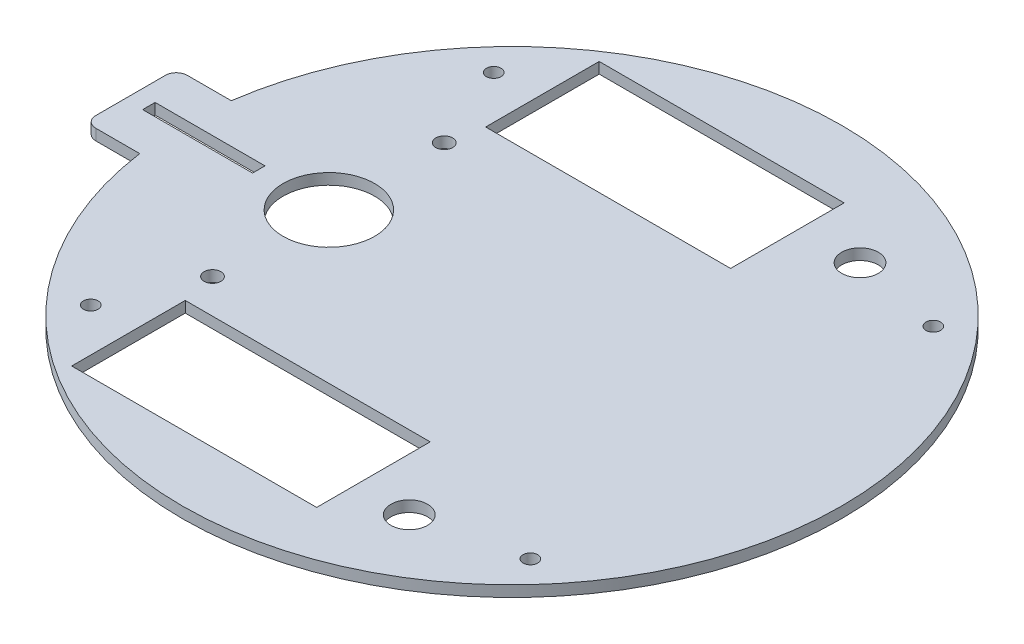
from build123d import *

# Parameters (mm, degrees)
SKETCH_2_R          = 90
EXTRUDE_1_DEPTH     = 3
SKETCH_3_W          = 66.868711174
SKETCH_3_H          = 31
CUT_EXTRUDE_1_DEPTH = 3
SKETCH_4_R          = 12.5
CUT_EXTRUDE_2_DEPTH = 3
SKETCH_5_R          = 2
CUT_EXTRUDE_3_DEPTH = 3
SKETCH_6_R          = 5
CUT_EXTRUDE_4_DEPTH = 10
SKETCH_7_R          = 2.3
CUT_EXTRUDE_5_DEPTH = 3
EXTRUDE_2_DEPTH     = 3
SKETCH_9_W          = 30
SKETCH_9_H          = 3.4
CUT_EXTRUDE_6_DEPTH = 3


with BuildPart() as part:
    # 草圖2 → 填料-伸長1 (new body)
    with BuildSketch(Plane(origin=(0, 0, 0), x_dir=(1, 0, 0), z_dir=(0, 1, 0))):
        with Locations(Location((0, 0, 0), (0, 0, 270))):
            Circle(SKETCH_2_R)
    extrude(amount=EXTRUDE_1_DEPTH)

    # 草圖3 → 除料-伸長1 (cut)
    with BuildSketch(Plane(origin=(0, 3, 0), x_dir=(1, 0, 0), z_dir=(0, 1, 0))):
        with Locations((-14.765632174, 56.5)):
            Rectangle(SKETCH_3_W, SKETCH_3_H)
        with Locations((-14.765632174, -56.5)):
            Rectangle(SKETCH_3_W, SKETCH_3_H)
    extrude(amount=-CUT_EXTRUDE_1_DEPTH, mode=Mode.SUBTRACT)

    # 草圖4 → 除料-伸長2 (cut)
    with BuildSketch(Plane(origin=(0, 3, 0), x_dir=(1, 0, 0), z_dir=(0, 1, 0))):
        with Locations(Location((-50, 0, 0), (0, 0, 270))):
            Circle(SKETCH_4_R)
    extrude(amount=-CUT_EXTRUDE_2_DEPTH, mode=Mode.SUBTRACT)

    # 草圖5 → 除料-伸長3 (cut)
    with BuildSketch(Plane(origin=(0, 3, 0), x_dir=(1, 0, 0), z_dir=(0, 1, 0))):
        with Locations(Location((-60, 55, 0), (0, 0, 270))):
            Circle(SKETCH_5_R)
        with Locations(Location((-60, -55, 0), (0, 0, 270))):
            Circle(SKETCH_5_R)
        with Locations(Location((60, -55, 0), (0, 0, 270))):
            Circle(SKETCH_5_R)
        with Locations(Location((60, 55, 0), (0, 0, 270))):
            Circle(SKETCH_5_R)
    extrude(amount=-CUT_EXTRUDE_3_DEPTH, mode=Mode.SUBTRACT)

    # 草圖6 → 除料-伸長4 (cut)
    with BuildSketch(Plane(origin=(0, 3, 0), x_dir=(1, 0, 0), z_dir=(0, 1, 0))):
        with Locations(Location((35, 60, 0), (0, 0, 270))):
            Circle(SKETCH_6_R)
        with Locations(Location((33.043068023, -61.099555282, 0), (0, 0, 270))):
            Circle(SKETCH_6_R)
    extrude(amount=-CUT_EXTRUDE_4_DEPTH, mode=Mode.SUBTRACT)

    # 草圖7 → 除料-伸長5 (cut)
    with BuildSketch(Plane(origin=(0, 3, 0), x_dir=(1, 0, 0), z_dir=(0, 1, 0))):
        with Locations(Location((-50.137404534, -31.624669079, 0), (0, 0, 270))):
            Circle(SKETCH_7_R)
        with Locations(Location((-50.137404534, 31.624669079, 0), (0, 0, 270))):
            Circle(SKETCH_7_R)
    extrude(amount=-CUT_EXTRUDE_5_DEPTH, mode=Mode.SUBTRACT)

    # 草圖8 → 填料-伸長2 (add)
    with BuildSketch(Plane(origin=(0, 3, 0), x_dir=(1, 0, 0), z_dir=(0, 1, 0))):
        with BuildLine():
            Line((-89.12771735, 12.5), (-101.12771735, 12.5))
            ThreePointArc((-101.12771735, 12.5), (-103.249037693, 11.621320344), (-104.12771735, 9.5))
            Line((-104.12771735, 9.5), (-104.12771735, -9.5))
            ThreePointArc((-104.12771735, -9.5), (-103.249037693, -11.621320344), (-101.12771735, -12.5))
            Line((-101.12771735, -12.5), (-89.12771735, -12.5))
            Line((-89.12771735, -12.5), (-89.12771735, 12.5))
        make_face()
    extrude(amount=-EXTRUDE_2_DEPTH)

    # 草圖9 → 除料-伸長6 (cut)
    with BuildSketch(Plane(origin=(0, 3, 0), x_dir=(1, 0, 0), z_dir=(0, 1, 0))):
        with Locations((-84.12771735, 0)):
            Rectangle(SKETCH_9_W, SKETCH_9_H)
    extrude(amount=-CUT_EXTRUDE_6_DEPTH, mode=Mode.SUBTRACT)


solid = part.part
